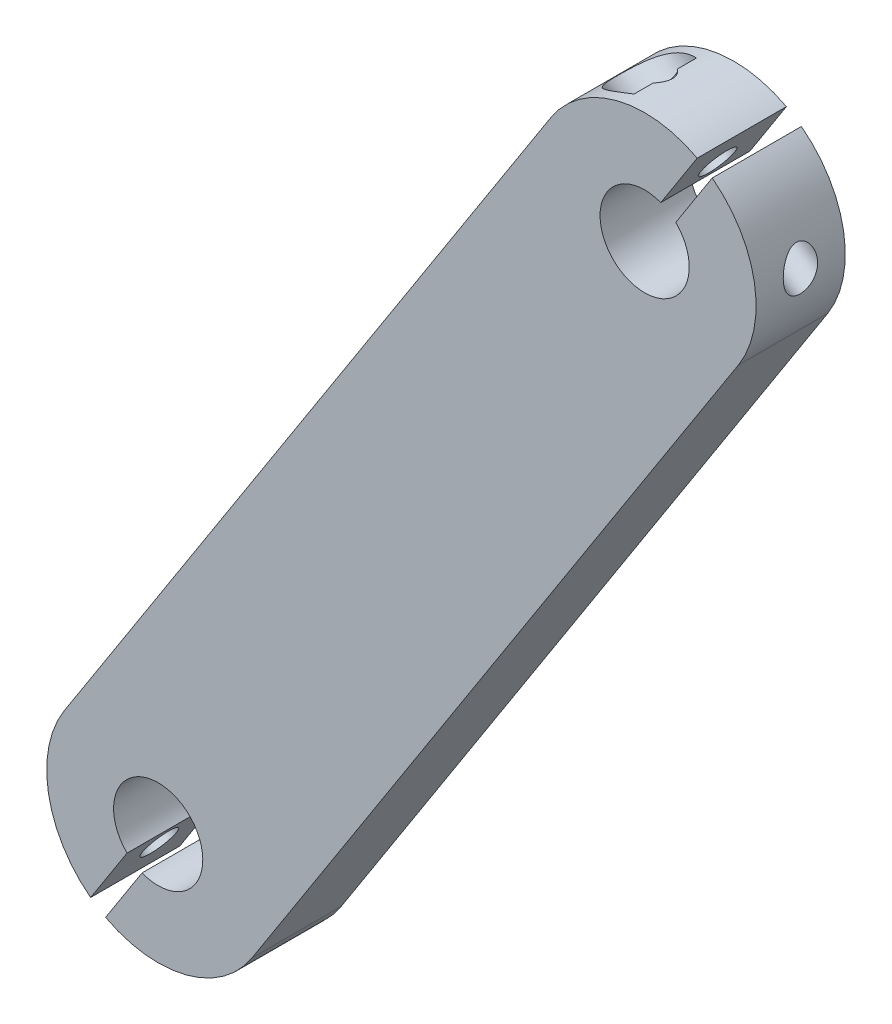
from build123d import *

# Parameters (mm, degrees)
SKETCH1_R                 = 3.175
BOSS_EXTRUDE1_DEPTH       = 6.35
CUT_EXTRUDE1_DEPTH        = 210.56202617
CBORE_FOR_2_1_D           = 2.4384
CBORE_FOR_2_1_CBORE_D     = 4.7625
CBORE_FOR_2_1_CBORE_DEPTH = 2.3114


with BuildPart() as part:
    # Sketch1 → Boss-Extrude1 (new body)
    with BuildSketch(Plane.XY):
        with BuildLine():
            Line((47.587554204, 128.214676374), (82.223145852, 182.092263381))
            ThreePointArc((82.223145852, 182.092263381), (93.192263381, 184.476854148), (95.576854148, 173.507736619))
            Line((95.576854148, 173.507736619), (60.941262501, 119.630149611))
            ThreePointArc((60.941262501, 119.630149611), (49.972144971, 117.245558844), (47.587554204, 128.214676374))
        make_face()
        with Locations((88.9, 177.8)):
            Circle(SKETCH1_R, mode=Mode.SUBTRACT)
        with Locations((54.264408352, 123.922412992)):
            Circle(SKETCH1_R, mode=Mode.SUBTRACT)
    extrude(amount=BOSS_EXTRUDE1_DEPTH)

    # Sketch2 → Cut-Extrude1 (cut, through all)
    with BuildSketch(Plane.XY.offset(6.35)):
        with BuildLine():
            Line((92.644357759, 184.79883499), (90.048068488, 180.760162791))
            ThreePointArc((90.048068488, 180.760162791), (90.616905352, 180.470741659), (91.116365152, 180.07340065))
            Line((91.116365152, 180.07340065), (93.712654423, 184.112072849))
            ThreePointArc((93.712654423, 184.112072849), (93.192263381, 184.476854148), (92.644357759, 184.79883499))
        make_face()
        with BuildLine():
            Line((52.0480432, 121.649012343), (49.451753929, 117.610340143))
            ThreePointArc((49.451753929, 117.610340143), (49.972144971, 117.245558844), (50.520050593, 116.923578002))
            Line((50.520050593, 116.923578002), (53.116339864, 120.962250202))
            ThreePointArc((53.116339864, 120.962250202), (52.547503, 121.251671333), (52.0480432, 121.649012343))
        make_face()
    extrude(amount=-CUT_EXTRUDE1_DEPTH, mode=Mode.SUBTRACT)

    # CBORE for #2 _1 (through all)
    with Locations(Plane(origin=(-24.649417325, 15.846053995, 0), x_dir=(0, 0, 1), z_dir=(-0.8411784753765535, 0.540757591313499, 0))):
        with Locations((3.175, 202.371942019), (3.175, 128.847697951)):
            CounterBoreHole(CBORE_FOR_2_1_D / 2, CBORE_FOR_2_1_CBORE_D / 2, CBORE_FOR_2_1_CBORE_DEPTH)


solid = part.part
